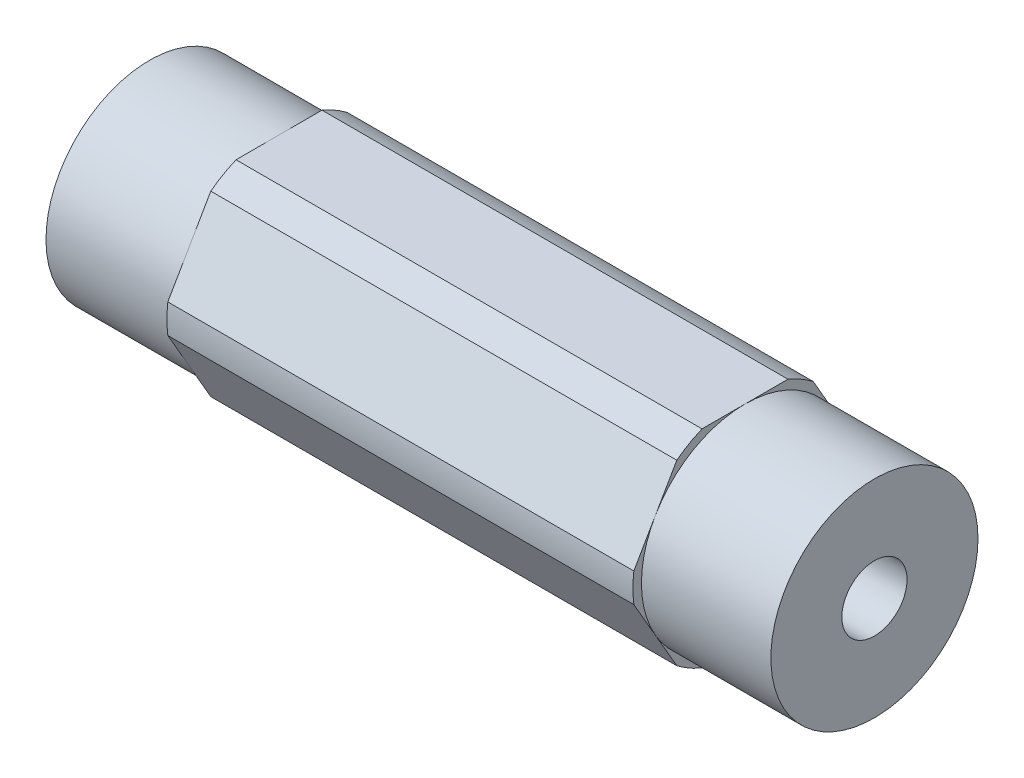
from build123d import *

# Parameters (mm, degrees)
SKETCH1_R               = 2.000000064
BOSS_EXTRUDE1_DEPTH     = 22.225
SKETCH4_R               = 8.89
SKETCH4_R_2             = 6.35
CUT_EXTRUDE_THIN1_DEPTH = 7.9375


with BuildPart() as part:
    # Sketch1 → Boss-Extrude1 (new, symmetric)
    with BuildSketch(Plane(origin=(0, 0, 0), x_dir=(0, 0, -1), z_dir=(1, 0, 0))):
        with BuildLine():
            ThreePointArc((6.874999966, 0), (6.860422465, 0.447468582), (6.816751782, 0.893039571))
            Line((6.816751782, 0.893039571), (4.181770846, 5.456960429))
            ThreePointArc((4.181770846, 5.456960429), (3.437499983, 5.953924622), (2.634980936, 6.35))
            Line((2.634980936, 6.35), (-2.634980936, 6.35))
            ThreePointArc((-2.634980936, 6.35), (-3.437499983, 5.953924622), (-4.181770846, 5.456960429))
            Line((-4.181770846, 5.456960429), (-6.816751782, 0.893039571))
            ThreePointArc((-6.816751782, 0.893039571), (-6.874999966, 0), (-6.816751782, -0.893039571))
            Line((-6.816751782, -0.893039571), (-4.181770846, -5.456960429))
            ThreePointArc((-4.181770846, -5.456960429), (-3.437499983, -5.953924622), (-2.634980936, -6.35))
            Line((-2.634980936, -6.35), (2.634980936, -6.35))
            ThreePointArc((2.634980936, -6.35), (3.437499983, -5.953924622), (4.181770846, -5.456960429))
            Line((4.181770846, -5.456960429), (6.816751782, -0.893039571))
            ThreePointArc((6.816751782, -0.893039571), (6.860422465, -0.447468582), (6.874999966, 0))
        make_face()
        Circle(SKETCH1_R, mode=Mode.SUBTRACT)
    extrude(amount=BOSS_EXTRUDE1_DEPTH, both=True)

    # Sketch4 → Cut-Extrude-Thin1 (cut)
    with BuildSketch(Plane.ZY.offset(22.225)):
        Circle(SKETCH4_R)
        Circle(SKETCH4_R_2, mode=Mode.SUBTRACT)
    cut_extrude_thin1 = extrude(amount=-CUT_EXTRUDE_THIN1_DEPTH, mode=Mode.SUBTRACT)

    # Mirror1: Cut-Extrude-Thin1 across plane
    add(cut_extrude_thin1.mirror(Plane.ZY), mode=Mode.SUBTRACT)


solid = part.part
